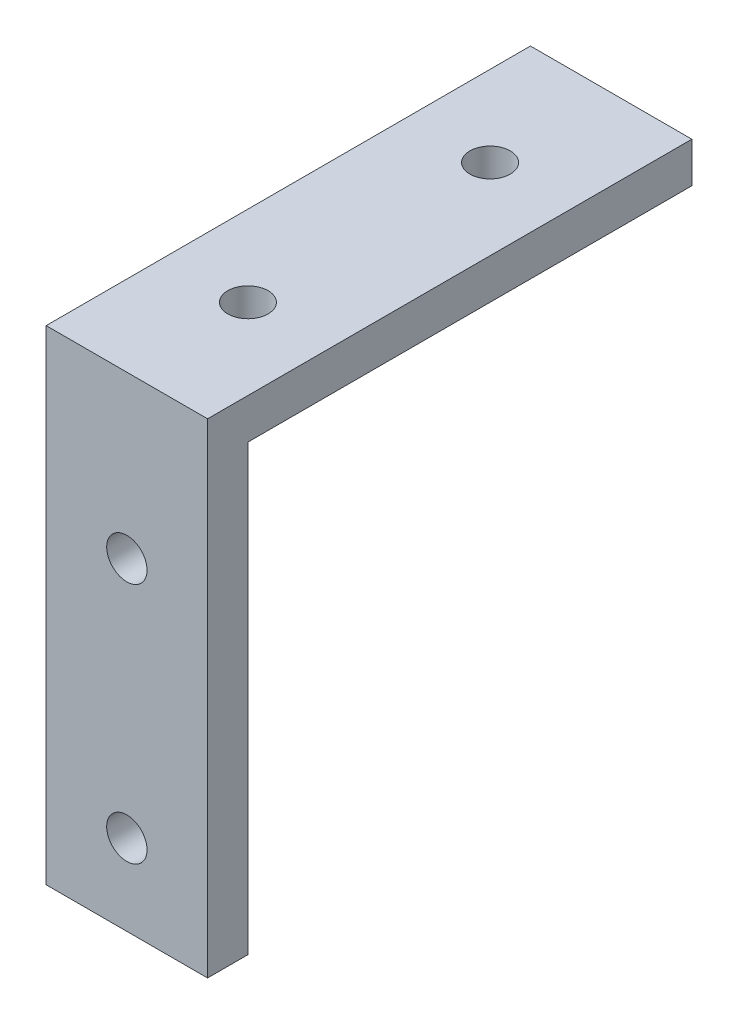
from build123d import *

# Parameters (mm, degrees)
BOSS_EXTRUDE1_DEPTH = 12.7
SKETCH2_R           = 3.175
CUT_EXTRUDE1_DEPTH  = 100.595858348
SKETCH3_R           = 3.175
CUT_EXTRUDE2_DEPTH  = 100.595858348


with BuildPart() as part:
    # Sketch1 → Boss-Extrude1 (new, symmetric)
    with BuildSketch(Plane(origin=(0, 0, 0), x_dir=(0, 0, -1), z_dir=(1, 0, 0))):
        Polygon((0, 0), (0, -69.85), (-6.35, -69.85), (-6.35, 6.35), (69.85, 6.35), (69.85, 0), align=None)
    extrude(amount=BOSS_EXTRUDE1_DEPTH, both=True)

    # Sketch2 → Cut-Extrude1 (cut, through all)
    with BuildSketch(Plane(origin=(0, 0, 0), x_dir=(1, 0, 0), z_dir=(0, 1, 0))):
        with Locations(Location((0, 50.8, 0), (0, 0, 90))):
            Circle(SKETCH2_R)
        with Locations(Location((0, 12.7, 0), (0, 0, 90))):
            Circle(SKETCH2_R)
    extrude(amount=CUT_EXTRUDE1_DEPTH, mode=Mode.SUBTRACT)

    # Sketch3 → Cut-Extrude2 (cut, through all)
    with BuildSketch(Plane.XY):
        with Locations((0, -57.15)):
            Circle(SKETCH3_R)
        with Locations((0, -19.05)):
            Circle(SKETCH3_R)
    extrude(amount=CUT_EXTRUDE2_DEPTH, mode=Mode.SUBTRACT)


solid = part.part
